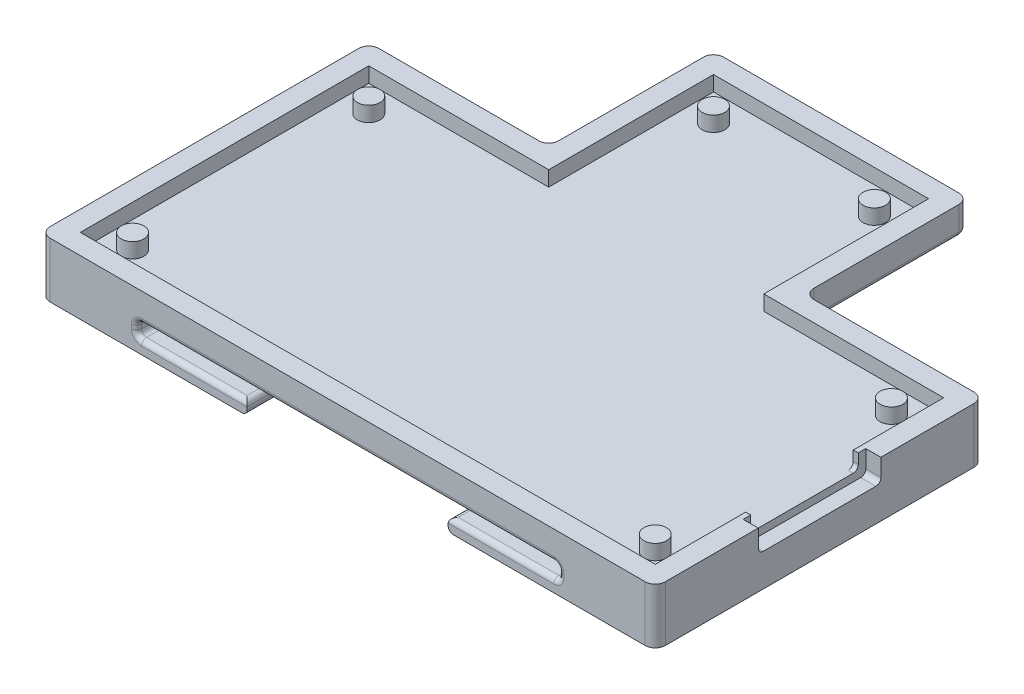
from build123d import *

# Parameters (mm, degrees)
BOSS_EXTRUDE1_DEPTH     = 1.5
BOSS_EXTRUDE2_START     = 1.5
SKETCH2_3_R             = 1.125
BOSS_EXTRUDE2_DEPTH     = 1.5
BOSS_EXTRUDE3_DEPTH     = 2.5
FILLET1_R               = 1
CUT_EXTRUDE1_DEPTH      = 45.921292279
CUT_EXTRUDE1_DEPTH_BACK = 45.921292279
SKETCH3_W               = 42
SKETCH3_H               = 1.4
SKETCH3_W_2             = 20
SKETCH3_H_2             = 1.25
CUT_EXTRUDE3_START      = -16.35
SKETCH3_4_W             = 5
SKETCH3_4_H             = 1.25
SKETCH3_4_W_2           = 20
CUT_EXTRUDE3_DEPTH      = 29.571292279
FILLET2_R               = 0.5
CUT_EXTRUDE2_START      = 0.75
SKETCH2_5_W             = 1.5
SKETCH2_5_H             = 0.75
SKETCH2_5_H_2           = 10.7
CUT_EXTRUDE2_DEPTH      = 0.75
FILLET3_R               = 0.5


with BuildPart() as part:
    # Sketch2 → Boss-Extrude1 (new body)
    with BuildSketch(Plane(origin=(0, 0, 0), x_dir=(1, 0, 0), z_dir=(0, 1, 0))):
        Polygon((12.7, 16.35), (12.7, 32.75), (-12.7, 32.75), (-12.7, 16.35), (-30.6, 16.35), (-30.6, -16.35), (30.6, -16.35), (30.6, 16.35), align=None)
    extrude(amount=BOSS_EXTRUDE1_DEPTH)

    # Sketch2<3> → Boss-Extrude2 (add)
    with BuildSketch(Plane(origin=(0, 0, 0), x_dir=(1, 0, 0), z_dir=(0, 1, 0)).offset(BOSS_EXTRUDE2_START)):
        Polygon((-30.6, 16.35), (-30.6, -16.35), (30.6, -16.35), (30.6, -6.1), (29.1, -6.1), (29.1, -5.35), (28.6, -5.35), (28.6, -14.35), (-28.6, -14.35), (-28.6, 14.35), (-10.7, 14.35), (-10.7, 30.75), (10.7, 30.75), (10.7, 14.35), (28.6, 14.35), (28.6, 5.35), (29.1, 5.35), (29.1, 6.1), (30.6, 6.1), (30.6, 16.35), (12.7, 16.35), (12.7, 32.75), (-12.7, 32.75), (-12.7, 16.35), align=None)
        with Locations(Location((-26, 11.75, 0), (0, 0, 270))):
            Circle(SKETCH2_3_R)
        with Locations(Location((-26, -11.75, 0), (0, 0, 270))):
            Circle(SKETCH2_3_R)
        with Locations(Location((26, -11.75, 0), (0, 0, 270))):
            Circle(SKETCH2_3_R)
        with Locations(Location((26, 11.75, 0), (0, 0, 270))):
            Circle(SKETCH2_3_R)
        with Locations(Location((8, 28.05, 0), (0, 0, 270))):
            Circle(SKETCH2_3_R)
        with Locations(Location((-8, 28.05, 0), (0, 0, 270))):
            Circle(SKETCH2_3_R)
    extrude(amount=BOSS_EXTRUDE2_DEPTH)

    # Sketch2<4> → Boss-Extrude3 (add)
    with BuildSketch(Plane(origin=(0, 0, 0), x_dir=(1, 0, 0), z_dir=(0, 1, 0))):
        Polygon((12.7, 16.35), (12.7, 32.75), (-12.7, 32.75), (-12.7, 16.35), (-30.6, 16.35), (-30.6, -16.35), (30.6, -16.35), (30.6, 16.35), align=None)
    extrude(amount=-BOSS_EXTRUDE3_DEPTH)

    # Fillet1
    fillet1_edges = [part.edges().sort_by_distance(p)[0] for p in [
        (30.6, 0.25, 16.35),
        (-30.6, 0.25, 16.35),
        (-30.6, 0.25, -16.35),
        (-12.7, 0.25, -16.35),
        (-12.7, 0.25, -32.75),
        (12.7, 0.25, -32.75),
        (12.7, 0.25, -16.35),
        (30.6, 0.25, -16.35),
    ]]
    fillet(fillet1_edges, radius=FILLET1_R)

    # Sketch3 → Cut-Extrude1 (cut, two sides: drawn at the far end of the back side and taken through both)
    with BuildSketch(Plane.XY.offset(-CUT_EXTRUDE1_DEPTH_BACK)):
        with Locations((0, -0.55)):
            Rectangle(SKETCH3_W, SKETCH3_H)
        with Locations((0, -1.875)):
            Rectangle(SKETCH3_W_2, SKETCH3_H_2)
    extrude(amount=CUT_EXTRUDE1_DEPTH + CUT_EXTRUDE1_DEPTH_BACK, mode=Mode.SUBTRACT)

    # Sketch3<4> → Cut-Extrude3 (cut, through all)
    with BuildSketch(Plane.XY.offset(CUT_EXTRUDE3_START)):
        with Locations((12.5, -1.875)):
            Rectangle(SKETCH3_4_W, SKETCH3_4_H)
        with Locations((0, -1.875)):
            Rectangle(SKETCH3_4_W_2, SKETCH3_4_H)
        with Locations((-12.5, -1.875)):
            Rectangle(SKETCH3_4_W, SKETCH3_4_H)
    extrude(amount=-CUT_EXTRUDE3_DEPTH, mode=Mode.SUBTRACT)

    # Fillet2
    fillet2_edges = [part.edges().sort_by_distance(p)[0] for p in [
        (-12.407106781, 0.15, -32.457106781),
        (21, -0.55, -16.35),
        (15.5, -1.25, -16.35),
        (-15.5, -1.25, -16.35),
        (12.7, 0.15, -24.55),
        (12.992893219, 0.15, -16.642893219),
        (-12.992893219, 0.15, -16.642893219),
        (-21, -0.55, -16.35),
        (-21, -1.25, 0),
        (-21, -0.55, 16.35),
        (17.35, 0.15, -16.35),
        (12.407106781, 0.15, -32.457106781),
        (-12.7, 0.15, -24.55),
        (-17.35, 0.15, -16.35),
        (-21, 0.15, 0),
        (0, 0.15, 16.35),
        (21, 0.15, 0),
        (21, -1.25, 0),
        (0, 0.15, -32.75),
        (-15.5, -1.25, 16.35),
        (15.5, -1.25, 16.35),
        (21, -0.55, 16.35),
        (-10, -2.5, 0),
        (-10, -1.25, 0),
        (10, -1.25, 0),
        (10, -2.5, 0),
    ]]
    fillet(fillet2_edges, radius=FILLET2_R)

    # Sketch2<5> → Cut-Extrude2 (cut)
    with BuildSketch(Plane(origin=(0, 0, 0), x_dir=(1, 0, 0), z_dir=(0, 1, 0)).offset(CUT_EXTRUDE2_START)):
        with Locations((29.85, 5.725)):
            Rectangle(SKETCH2_5_W, SKETCH2_5_H)
        with Locations((29.85, 0)):
            Rectangle(SKETCH2_5_W, SKETCH2_5_H_2)
        with Locations((29.85, -5.725)):
            Rectangle(SKETCH2_5_W, SKETCH2_5_H)
    extrude(amount=CUT_EXTRUDE2_DEPTH, mode=Mode.SUBTRACT)

    # Fillet3
    fillet3_edges = [part.edges().sort_by_distance(p)[0] for p in [
        (29.85, 0.75, 6.1),
        (29.85, 0.75, -6.1),
        (28.85, 1.5, -5.35),
        (28.85, 1.5, 5.35),
    ]]
    fillet(fillet3_edges, radius=FILLET3_R)


solid = part.part
